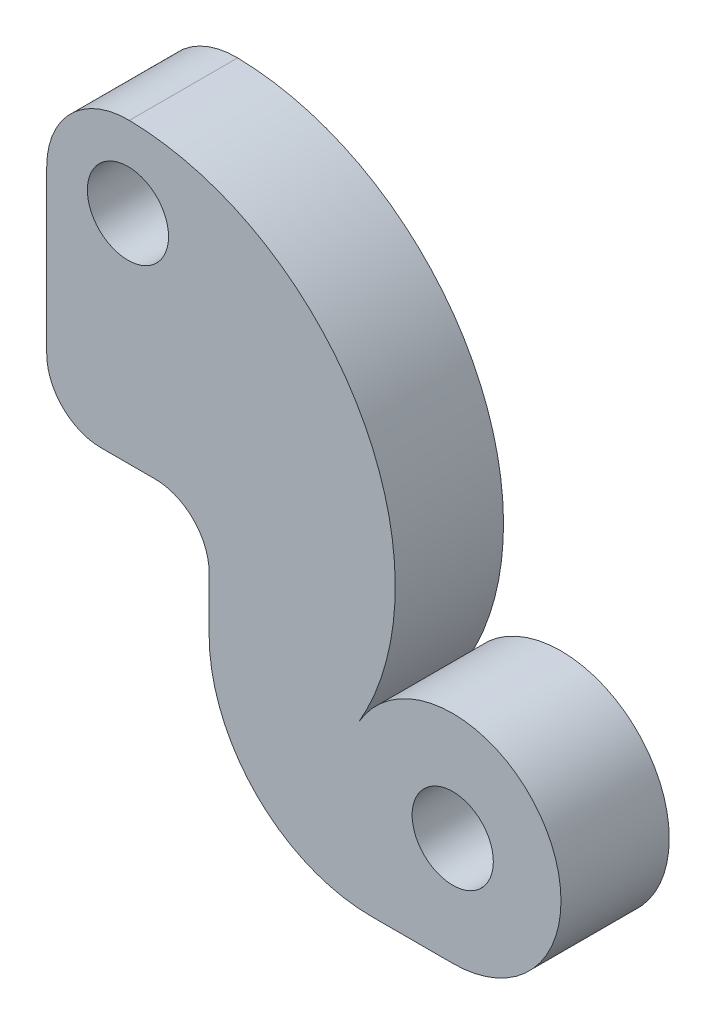
from build123d import *

# Parameters (mm, degrees)
SKETCH1_R           = 7.5
BOSS_EXTRUDE1_DEPTH = 10


with BuildPart() as part:
    # Sketch1 → Boss-Extrude1 (new, symmetric)
    with BuildSketch(Plane.XY):
        with BuildLine():
            Line((-75, 70), (-75, 40))
            ThreePointArc((-75, 40), (-72.071067812, 32.928932188), (-65, 30))
            Line((-65, 30), (-55, 30))
            ThreePointArc((-55, 30), (-47.928932188, 27.071067812), (-45, 20))
            Line((-45, 20), (-45, 10))
            ThreePointArc((-45, 10), (-36.213203436, -11.213203436), (-15, -20))
            Line((-15, -20), (0, -20))
            ThreePointArc((0, -20), (17.320959018, 9.999218904), (-17.319606085, 10.001562131))
            ThreePointArc((-17.319606085, 10.001562131), (-17.096987337, 59.619840851), (-59.734876587, 84.997656803))
            ThreePointArc((-59.734876587, 84.997656803), (-70.512448545, 80.699926429), (-75, 70))
        make_face()
        Circle(SKETCH1_R, mode=Mode.SUBTRACT)
        with Locations((-60, 70)):
            Circle(SKETCH1_R, mode=Mode.SUBTRACT)
    extrude(amount=BOSS_EXTRUDE1_DEPTH, both=True)


solid = part.part
